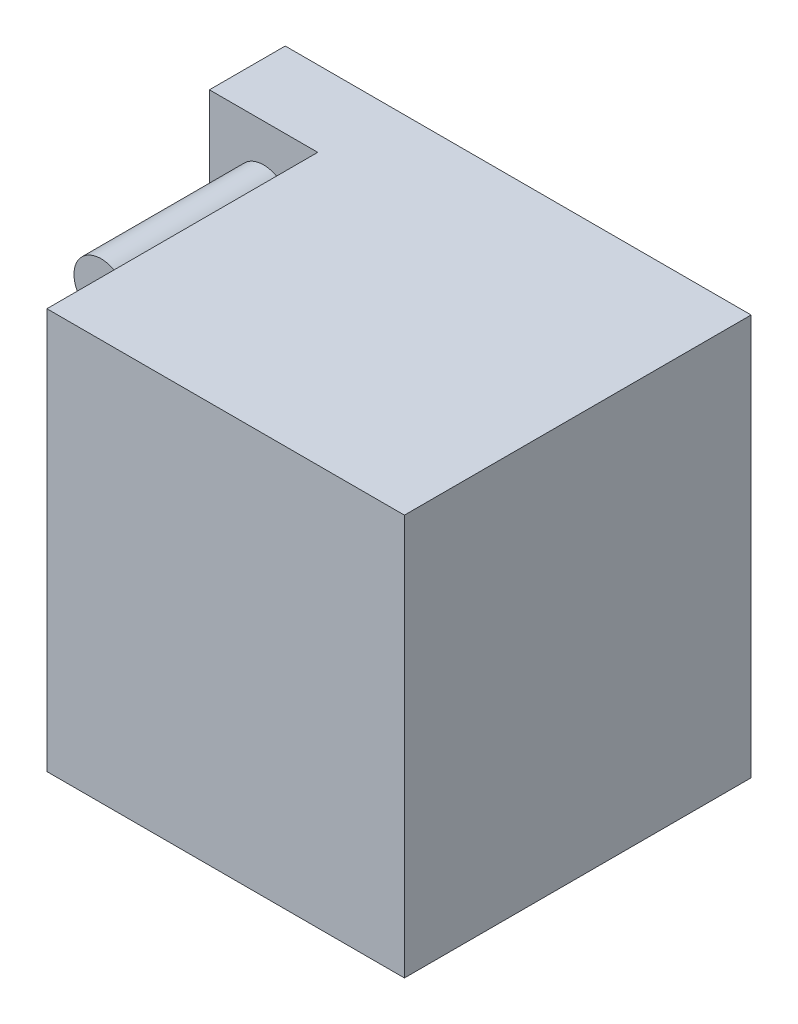
from build123d import *

# Parameters (mm, degrees)
SKETCH1_W           = 43
SKETCH1_H           = 37
BOSS_EXTRUDE1_DEPTH = 32
SKETCH2_W           = 10
SKETCH2_H           = 37
CUT_EXTRUDE1_DEPTH  = 25
SKETCH3_R           = 2.5
BOSS_EXTRUDE2_DEPTH = 15


with BuildPart() as part:
    # Sketch1 → Boss-Extrude1 (new body)
    with BuildSketch(Plane.XY):
        with Locations((21.5, -18.5)):
            Rectangle(SKETCH1_W, SKETCH1_H)
    extrude(amount=BOSS_EXTRUDE1_DEPTH)

    # Sketch2 → Cut-Extrude1 (cut)
    with BuildSketch(Plane.XY.offset(32)):
        with Locations((5, -18.5)):
            Rectangle(SKETCH2_W, SKETCH2_H)
    extrude(amount=-CUT_EXTRUDE1_DEPTH, mode=Mode.SUBTRACT)

    # Sketch3 → Boss-Extrude2 (add)
    with BuildSketch(Plane.XY.offset(7)):
        with Locations((5, -6)):
            Circle(SKETCH3_R)
        with Locations((5, -14)):
            Circle(SKETCH3_R)
        with Locations((5, -22)):
            Circle(SKETCH3_R)
        with Locations((5, -30)):
            Circle(SKETCH3_R)
    extrude(amount=BOSS_EXTRUDE2_DEPTH)


solid = part.part
